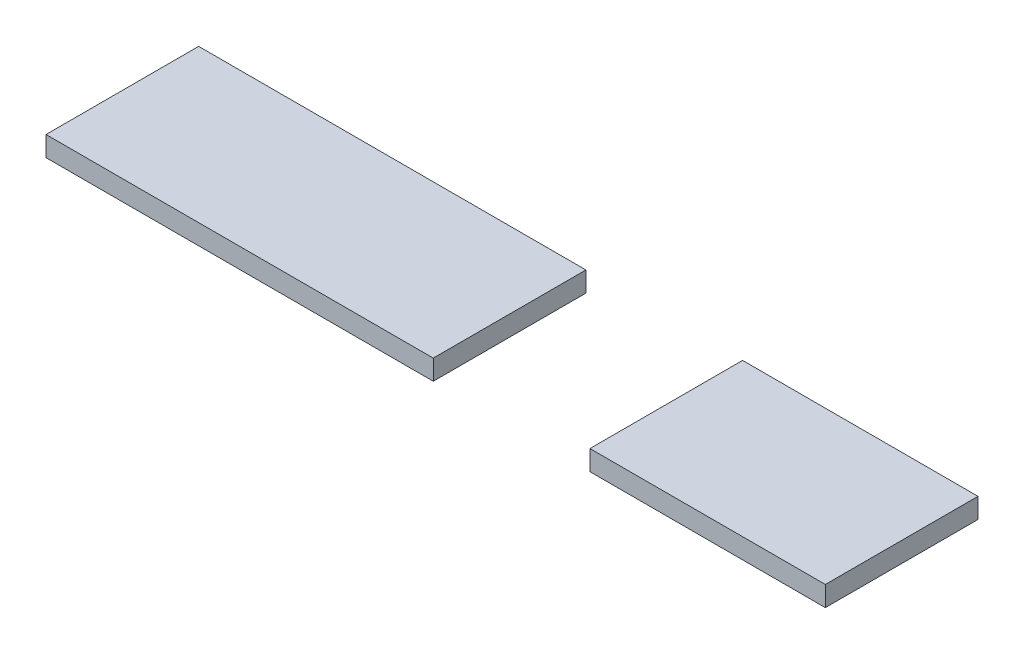
from build123d import *

# Parameters (mm, degrees)
SKETCH1_W             = 48.2
SKETCH1_H             = 19
BOSS_EXTRUDE1_DEPTH   = 2.5
SKETCH1_W_2           = 29.3
BOSS_EXTRUDE1_2_DEPTH = 2.5


with BuildPart() as part:
    # Sketch1 → Boss-Extrude1 (new body)
    with BuildSketch(Plane(origin=(0, 0, 0), x_dir=(1, 0, 0), z_dir=(0, 1, 0))):
        with Locations((-77.148785611, 9.5)):
            Rectangle(SKETCH1_W, SKETCH1_H)
    extrude(amount=BOSS_EXTRUDE1_DEPTH)


with BuildPart() as body_2:
    # Sketch1 → Boss-Extrude1 2 (new body)
    with BuildSketch(Plane(origin=(0, 0, 0), x_dir=(1, 0, 0), z_dir=(0, 1, 0))):
        with Locations((-18.898785611, 9.5)):
            Rectangle(SKETCH1_W_2, SKETCH1_H)
    extrude(amount=BOSS_EXTRUDE1_2_DEPTH)


solid = Compound([part.part, body_2.part])
